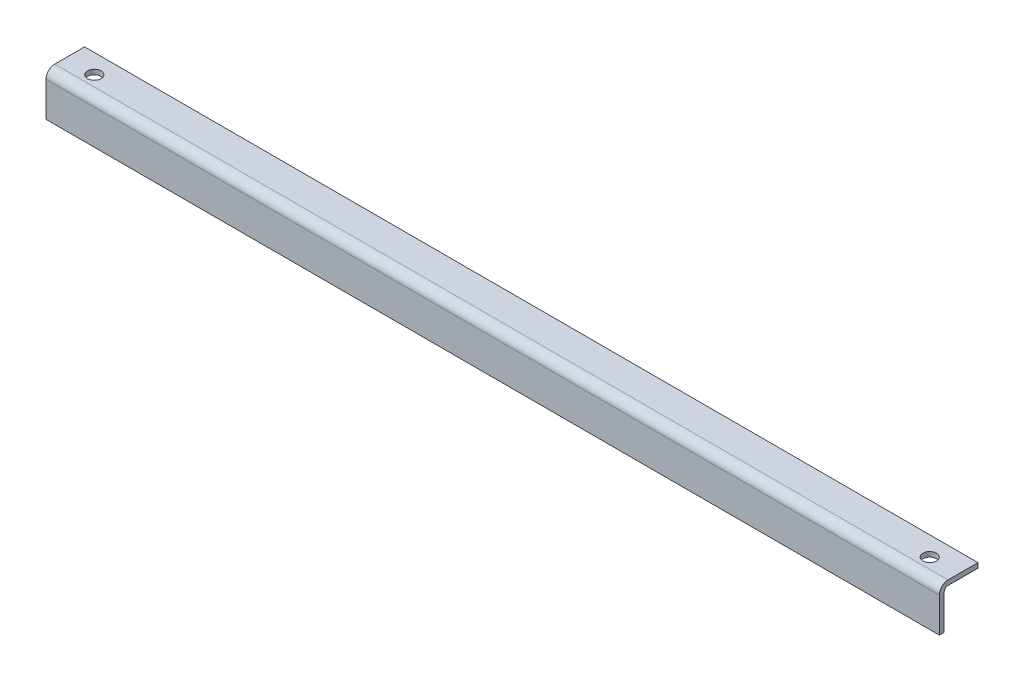
from build123d import *

# Parameters (mm, degrees)
SKETCH1_W           = 462.50664735
SKETCH1_H           = 20
BOSS_EXTRUDE1_DEPTH = 2.5
SKETCH2_R           = 3.5
CUT_EXTRUDE1_DEPTH  = 2.5
SKETCH3_W           = 462.50664735
SKETCH3_H           = 2.5
BOSS_EXTRUDE2_DEPTH = 20
FILLET1_R           = 2
FILLET2_R           = 4.5


with BuildPart() as part:
    # Sketch1 → Boss-Extrude1 (new body)
    with BuildSketch(Plane(origin=(0, 0, 0), x_dir=(1, 0, 0), z_dir=(0, 1, 0))):
        Rectangle(SKETCH1_W, SKETCH1_H)
    extrude(amount=BOSS_EXTRUDE1_DEPTH)

    # Sketch2 → Cut-Extrude1 (cut)
    with BuildSketch(Plane(origin=(0, 2.5, 0), x_dir=(1, 0, 0), z_dir=(0, 1, 0))):
        with Locations(Location((216.253323675, 0, 0), (0, 0, 270))):
            Circle(SKETCH2_R)
        with Locations(Location((-216.253323675, 0, 0), (0, 0, 270))):
            Circle(SKETCH2_R)
    extrude(amount=-CUT_EXTRUDE1_DEPTH, mode=Mode.SUBTRACT)

    # Sketch3 → Boss-Extrude2 (add)
    with BuildSketch(Plane.XZ):
        with Locations((0, 8.75)):
            Rectangle(SKETCH3_W, SKETCH3_H)
    extrude(amount=BOSS_EXTRUDE2_DEPTH)

    # Fillet1
    fillet1_edges = [part.edges().sort_by_distance(p)[0] for p in [
        (0, 0, 7.5),
    ]]
    fillet(fillet1_edges, radius=FILLET1_R)

    # Fillet2
    fillet2_edges = [part.edges().sort_by_distance(p)[0] for p in [
        (0, 2.5, 10),
    ]]
    fillet(fillet2_edges, radius=FILLET2_R)


solid = part.part
